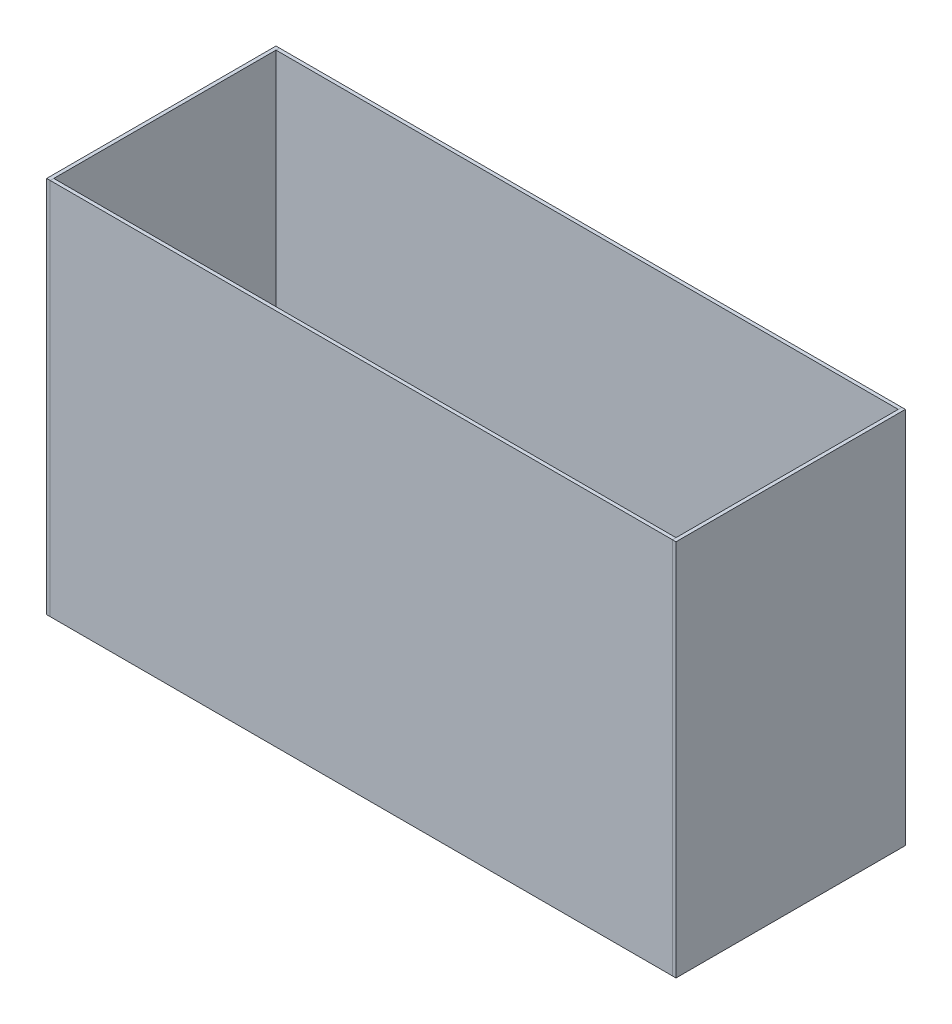
from build123d import *

# Parameters (mm, degrees)
PC_OBSERVATION_WALL_LEFT_T8_START  = -8
SKETCH_1_W                         = 1400
SKETCH_1_H                         = 850
PC_OBSERVATION_WALL_LEFT_T8_DEPTH  = 8
PC_OBSERVATION_WALL_RIGHT_T8_START = 500
SKETCH_2_W                         = 1400
SKETCH_2_H                         = 850
PC_OBSERVATION_WALL_RIGHT_T8_DEPTH = 8
PC_REAR_END_T8_START               = -8
SKETCH_3_W                         = 8
SKETCH_3_H                         = 850
PC_REAR_END_T8_DEPTH               = 516
PC_TOE_END_T8_START                = -8
SKETCH_4_W                         = 8
SKETCH_4_H                         = 850
PC_TOE_END_T8_DEPTH                = 516


with BuildPart() as part:
    # 草图1 → PC_observation_wall_left_t8 (new body)
    with BuildSketch(Plane.XY.offset(PC_OBSERVATION_WALL_LEFT_T8_START)):
        with Locations((700, 425)):
            Rectangle(SKETCH_1_W, SKETCH_1_H)
    extrude(amount=PC_OBSERVATION_WALL_LEFT_T8_DEPTH)


with BuildPart() as body_2:
    # 草图2 → PC_observation_wall_right_t8 (new body)
    with BuildSketch(Plane.XY.offset(PC_OBSERVATION_WALL_RIGHT_T8_START)):
        with Locations((700, 425)):
            Rectangle(SKETCH_2_W, SKETCH_2_H)
    extrude(amount=PC_OBSERVATION_WALL_RIGHT_T8_DEPTH)


with BuildPart() as body_3:
    # 草图3 → PC_rear_end_t8 (new body)
    with BuildSketch(Plane.XY.offset(PC_REAR_END_T8_START)):
        with Locations((-4, 425)):
            Rectangle(SKETCH_3_W, SKETCH_3_H)
    extrude(amount=PC_REAR_END_T8_DEPTH)


with BuildPart() as body_4:
    # 草图4 → PC_toe_end_t8 (new body)
    with BuildSketch(Plane.XY.offset(PC_TOE_END_T8_START)):
        with Locations((1404, 425)):
            Rectangle(SKETCH_4_W, SKETCH_4_H)
    extrude(amount=PC_TOE_END_T8_DEPTH)


solid = Compound([part.part, body_2.part, body_3.part, body_4.part])
